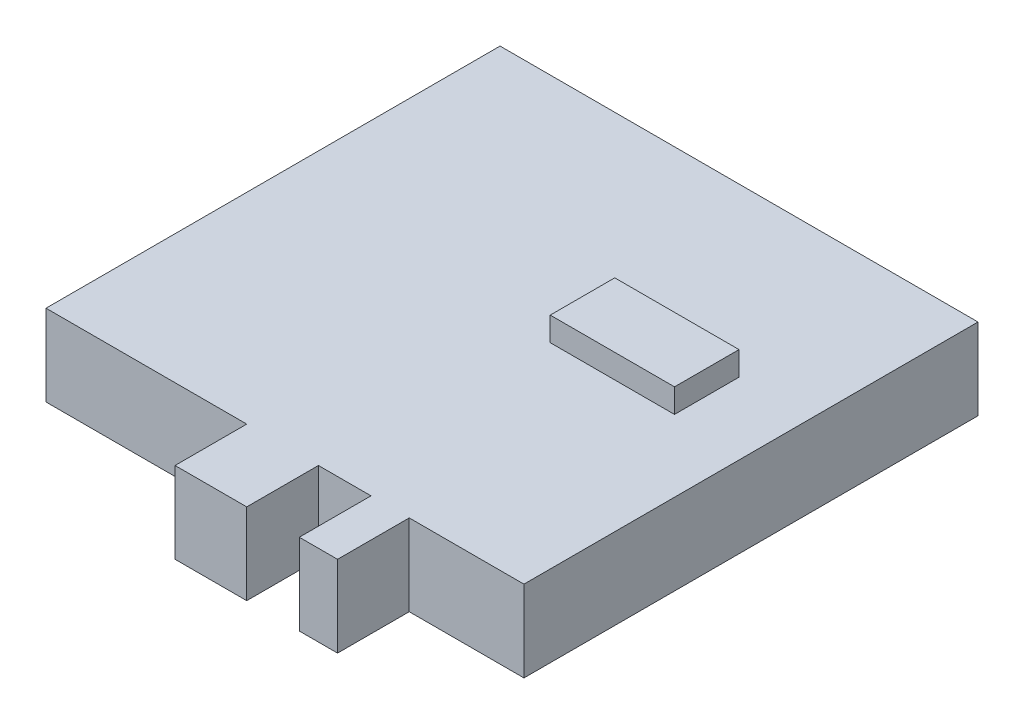
from build123d import *

# Parameters (mm, degrees)
BOSS_EXTRUDE9_DEPTH  = 17
SKETCH5_W            = 26
SKETCH5_H            = 13.5
BOSS_EXTRUDE10_DEPTH = 5


with BuildPart() as part:
    # Sketch1 → Boss-Extrude9 (new body)
    with BuildSketch(Plane(origin=(0, 0, 0), x_dir=(1, 0, 0), z_dir=(0, 1, 0))):
        Polygon((24.931466627, -43.41497766), (35.931466627, -43.41497766), (35.931466627, -58.41497766), (43.931466627, -58.41497766), (43.931466627, -43.41497766), (67.931466627, -43.41497766), (67.931466627, 51.58502234), (-32.068533373, 51.58502234), (-32.068533373, -43.41497766), (9.931466627, -43.41497766), (9.931466627, -58.41497766), (24.931466627, -58.41497766), align=None)
    extrude(amount=BOSS_EXTRUDE9_DEPTH)

    # Sketch5 → Boss-Extrude10 (add)
    with BuildSketch(Plane(origin=(0, 17, 0), x_dir=(1, 0, 0), z_dir=(0, 1, 0))):
        with Locations((39.931466627, 9.83502234)):
            Rectangle(SKETCH5_W, SKETCH5_H)
    extrude(amount=BOSS_EXTRUDE10_DEPTH)


solid = part.part
